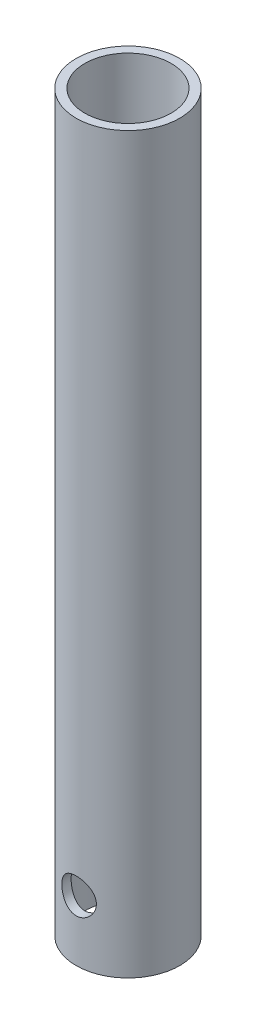
from build123d import *

# Parameters (mm, degrees)
SKETCH_1_R               = 6
SKETCH_1_R_2             = 5
EXTRUDE_1_DEPTH          = 85
CUT_EXTRUDE_1_DEPTH      = 86.422479477
CUT_EXTRUDE_1_DEPTH_BACK = 86.422479477
SKETCH_2_R               = 2


with BuildPart() as part:
    # 草图1 → 拉伸-薄壁1 (new body)
    with BuildSketch(Plane(origin=(0, 0, 0), x_dir=(1, 0, 0), z_dir=(0, 1, 0))):
        Circle(SKETCH_1_R)
        Circle(SKETCH_1_R_2, mode=Mode.SUBTRACT)
    extrude(amount=EXTRUDE_1_DEPTH)

    # 草图2 → 切除-拉伸1 (cut, two sides: drawn at the far end of the back side and taken through both)
    with BuildSketch(Plane.XY.offset(-CUT_EXTRUDE_1_DEPTH_BACK)):
        with Locations((0, 7)):
            Circle(SKETCH_2_R)
    extrude(amount=CUT_EXTRUDE_1_DEPTH + CUT_EXTRUDE_1_DEPTH_BACK, mode=Mode.SUBTRACT)


solid = part.part
